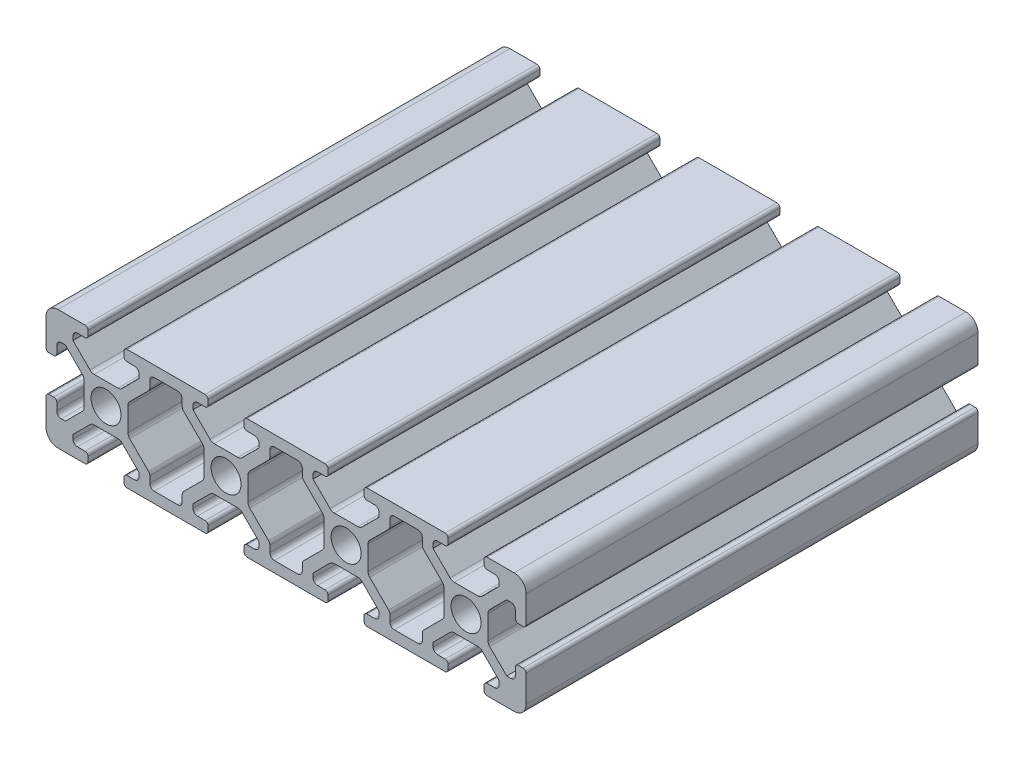
from build123d import *

# Parameters (mm, degrees)
SKETCH1_R           = 2.5
BOSS_EXTRUDE1_DEPTH = 75.3


with BuildPart() as part:
    # Sketch1 → Boss-Extrude1 (new body)
    with BuildSketch(Plane.XY):
        with BuildLine():
            Line((-37.639184242, -10.360815758), (-33.139184242, -10.360815758))
            ThreePointArc((-33.139184242, -10.360815758), (-32.785630852, -10.214369148), (-32.639184242, -9.860815758))
            Line((-32.639184242, -9.860815758), (-32.639184242, -9.060815758))
            ThreePointArc((-32.639184242, -9.060815758), (-32.785630852, -8.707262367), (-33.139184242, -8.560815758))
            Line((-33.139184242, -8.560815758), (-34.389184242, -8.560815758))
            ThreePointArc((-34.389184242, -8.560815758), (-34.919514328, -8.341145844), (-35.139184242, -7.810815758))
            Line((-35.139184242, -7.810815758), (-35.139184242, -7.133607964))
            Line((-35.139184242, -7.133607964), (-32.309285255, -4.303708976))
            ThreePointArc((-32.309285255, -4.303708976), (-31.984861906, -4.086936225), (-31.602178474, -4.010815758))
            Line((-31.602178474, -4.010815758), (-27.676190011, -4.010815758))
            ThreePointArc((-27.676190011, -4.010815758), (-27.293506578, -4.086936225), (-26.96908323, -4.303708976))
            Line((-26.96908323, -4.303708976), (-24.139184242, -7.133607964))
            Line((-24.139184242, -7.133607964), (-24.139184242, -7.810815758))
            ThreePointArc((-24.139184242, -7.810815758), (-24.358854156, -8.341145844), (-24.889184242, -8.560815758))
            Line((-24.889184242, -8.560815758), (-26.139184242, -8.560815758))
            ThreePointArc((-26.139184242, -8.560815758), (-26.492737633, -8.707262367), (-26.639184242, -9.060815758))
            Line((-26.639184242, -9.060815758), (-26.639184242, -9.860815758))
            ThreePointArc((-26.639184242, -9.860815758), (-26.492737633, -10.214369148), (-26.139184242, -10.360815758))
            Line((-26.139184242, -10.360815758), (-13.139184242, -10.360815758))
            ThreePointArc((-13.139184242, -10.360815758), (-12.785630852, -10.214369148), (-12.639184242, -9.860815758))
            Line((-12.639184242, -9.860815758), (-12.639184242, -9.060815758))
            ThreePointArc((-12.639184242, -9.060815758), (-12.785630852, -8.707262367), (-13.139184242, -8.560815758))
            Line((-13.139184242, -8.560815758), (-14.389184242, -8.560815758))
            ThreePointArc((-14.389184242, -8.560815758), (-14.919514328, -8.341145844), (-15.139184242, -7.810815758))
            Line((-15.139184242, -7.810815758), (-15.139184242, -7.133607964))
            Line((-15.139184242, -7.133607964), (-12.309285255, -4.303708976))
            ThreePointArc((-12.309285255, -4.303708976), (-11.984861906, -4.086936225), (-11.602178474, -4.010815758))
            Line((-11.602178474, -4.010815758), (-7.676190011, -4.010815758))
            ThreePointArc((-7.676190011, -4.010815758), (-7.293506578, -4.086936225), (-6.96908323, -4.303708976))
            Line((-6.96908323, -4.303708976), (-4.139184242, -7.133607964))
            Line((-4.139184242, -7.133607964), (-4.139184242, -7.810815758))
            ThreePointArc((-4.139184242, -7.810815758), (-4.358854156, -8.341145844), (-4.889184242, -8.560815758))
            Line((-4.889184242, -8.560815758), (-6.139184242, -8.560815758))
            ThreePointArc((-6.139184242, -8.560815758), (-6.492737633, -8.707262367), (-6.639184242, -9.060815758))
            Line((-6.639184242, -9.060815758), (-6.639184242, -9.860815758))
            ThreePointArc((-6.639184242, -9.860815758), (-6.492737633, -10.214369148), (-6.139184242, -10.360815758))
            Line((-6.139184242, -10.360815758), (6.860815758, -10.360815758))
            ThreePointArc((6.860815758, -10.360815758), (7.214369148, -10.214369148), (7.360815758, -9.860815758))
            Line((7.360815758, -9.860815758), (7.360815758, -9.060815758))
            ThreePointArc((7.360815758, -9.060815758), (7.214369148, -8.707262367), (6.860815758, -8.560815758))
            Line((6.860815758, -8.560815758), (5.610815758, -8.560815758))
            ThreePointArc((5.610815758, -8.560815758), (5.080485672, -8.341145844), (4.860815758, -7.810815758))
            Line((4.860815758, -7.810815758), (4.860815758, -7.133607964))
            Line((4.860815758, -7.133607964), (7.690714745, -4.303708976))
            ThreePointArc((7.690714745, -4.303708976), (8.015138094, -4.086936225), (8.397821526, -4.010815758))
            Line((8.397821526, -4.010815758), (12.323809989, -4.010815758))
            ThreePointArc((12.323809989, -4.010815758), (12.706493422, -4.086936225), (13.03091677, -4.303708976))
            Line((13.03091677, -4.303708976), (15.860815758, -7.133607964))
            Line((15.860815758, -7.133607964), (15.860815758, -7.810815758))
            ThreePointArc((15.860815758, -7.810815758), (15.641145844, -8.341145844), (15.110815758, -8.560815758))
            Line((15.110815758, -8.560815758), (13.860815758, -8.560815758))
            ThreePointArc((13.860815758, -8.560815758), (13.507262367, -8.707262367), (13.360815758, -9.060815758))
            Line((13.360815758, -9.060815758), (13.360815758, -9.860815758))
            ThreePointArc((13.360815758, -9.860815758), (13.507262367, -10.214369148), (13.860815758, -10.360815758))
            Line((13.860815758, -10.360815758), (26.860815758, -10.360815758))
            ThreePointArc((26.860815758, -10.360815758), (27.214369148, -10.214369148), (27.360815758, -9.860815758))
            Line((27.360815758, -9.860815758), (27.360815758, -9.060815758))
            ThreePointArc((27.360815758, -9.060815758), (27.214369148, -8.707262367), (26.860815758, -8.560815758))
            Line((26.860815758, -8.560815758), (25.610815758, -8.560815758))
            ThreePointArc((25.610815758, -8.560815758), (25.080485672, -8.341145844), (24.860815758, -7.810815758))
            Line((24.860815758, -7.810815758), (24.860815758, -7.133607964))
            Line((24.860815758, -7.133607964), (27.690714745, -4.303708976))
            ThreePointArc((27.690714745, -4.303708976), (28.015138094, -4.086936225), (28.397821526, -4.010815758))
            Line((28.397821526, -4.010815758), (32.323809989, -4.010815758))
            ThreePointArc((32.323809989, -4.010815758), (32.706493422, -4.086936225), (33.03091677, -4.303708976))
            Line((33.03091677, -4.303708976), (35.860815758, -7.133607964))
            Line((35.860815758, -7.133607964), (35.860815758, -7.810815758))
            ThreePointArc((35.860815758, -7.810815758), (35.641145844, -8.341145844), (35.110815758, -8.560815758))
            Line((35.110815758, -8.560815758), (33.860815758, -8.560815758))
            ThreePointArc((33.860815758, -8.560815758), (33.507262367, -8.707262367), (33.360815758, -9.060815758))
            Line((33.360815758, -9.060815758), (33.360815758, -9.860815758))
            ThreePointArc((33.360815758, -9.860815758), (33.507262367, -10.214369148), (33.860815758, -10.360815758))
            Line((33.860815758, -10.360815758), (38.360815758, -10.360815758))
            ThreePointArc((38.360815758, -10.360815758), (39.77502932, -9.77502932), (40.360815758, -8.360815758))
            Line((40.360815758, -8.360815758), (40.360815758, -3.860815758))
            ThreePointArc((40.360815758, -3.860815758), (40.214369148, -3.507262367), (39.860815758, -3.360815758))
            Line((39.860815758, -3.360815758), (39.060815758, -3.360815758))
            ThreePointArc((39.060815758, -3.360815758), (38.707262367, -3.507262367), (38.560815758, -3.860815758))
            Line((38.560815758, -3.860815758), (38.560815758, -5.110815758))
            ThreePointArc((38.560815758, -5.110815758), (38.341145844, -5.641145844), (37.810815758, -5.860815758))
            Line((37.810815758, -5.860815758), (37.133607964, -5.860815758))
            Line((37.133607964, -5.860815758), (34.303708976, -3.03091677))
            ThreePointArc((34.303708976, -3.03091677), (34.086936225, -2.706493422), (34.010815758, -2.323809989))
            Line((34.010815758, -2.323809989), (34.010815758, 1.602178474))
            ThreePointArc((34.010815758, 1.602178474), (34.086936225, 1.984861906), (34.303708976, 2.309285255))
            Line((34.303708976, 2.309285255), (37.133607964, 5.139184242))
            Line((37.133607964, 5.139184242), (37.810815758, 5.139184242))
            ThreePointArc((37.810815758, 5.139184242), (38.341145844, 4.919514328), (38.560815758, 4.389184242))
            Line((38.560815758, 4.389184242), (38.560815758, 3.139184242))
            ThreePointArc((38.560815758, 3.139184242), (38.707262367, 2.785630852), (39.060815758, 2.639184242))
            Line((39.060815758, 2.639184242), (39.860815758, 2.639184242))
            ThreePointArc((39.860815758, 2.639184242), (40.214369148, 2.785630852), (40.360815758, 3.139184242))
            Line((40.360815758, 3.139184242), (40.360815758, 7.639184242))
            ThreePointArc((40.360815758, 7.639184242), (39.77502932, 9.053397805), (38.360815758, 9.639184242))
            Line((38.360815758, 9.639184242), (33.860815758, 9.639184242))
            ThreePointArc((33.860815758, 9.639184242), (33.507262367, 9.492737633), (33.360815758, 9.139184242))
            Line((33.360815758, 9.139184242), (33.360815758, 8.339184242))
            ThreePointArc((33.360815758, 8.339184242), (33.507262367, 7.985630852), (33.860815758, 7.839184242))
            Line((33.860815758, 7.839184242), (35.110815758, 7.839184242))
            ThreePointArc((35.110815758, 7.839184242), (35.641145844, 7.619514328), (35.860815758, 7.089184242))
            Line((35.860815758, 7.089184242), (35.860815758, 6.411976448))
            Line((35.860815758, 6.411976448), (33.03091677, 3.582077461))
            ThreePointArc((33.03091677, 3.582077461), (32.706493422, 3.36530471), (32.323809989, 3.289184242))
            Line((32.323809989, 3.289184242), (28.397821526, 3.289184242))
            ThreePointArc((28.397821526, 3.289184242), (28.015138094, 3.36530471), (27.690714745, 3.582077461))
            Line((27.690714745, 3.582077461), (24.860815758, 6.411976448))
            Line((24.860815758, 6.411976448), (24.860815758, 7.089184242))
            ThreePointArc((24.860815758, 7.089184242), (25.080485672, 7.619514328), (25.610815758, 7.839184242))
            Line((25.610815758, 7.839184242), (26.860815758, 7.839184242))
            ThreePointArc((26.860815758, 7.839184242), (27.214369148, 7.985630852), (27.360815758, 8.339184242))
            Line((27.360815758, 8.339184242), (27.360815758, 9.139184242))
            ThreePointArc((27.360815758, 9.139184242), (27.214369148, 9.492737633), (26.860815758, 9.639184242))
            Line((26.860815758, 9.639184242), (13.860815758, 9.639184242))
            ThreePointArc((13.860815758, 9.639184242), (13.507262367, 9.492737633), (13.360815758, 9.139184242))
            Line((13.360815758, 9.139184242), (13.360815758, 8.339184242))
            ThreePointArc((13.360815758, 8.339184242), (13.507262367, 7.985630852), (13.860815758, 7.839184242))
            Line((13.860815758, 7.839184242), (15.110815758, 7.839184242))
            ThreePointArc((15.110815758, 7.839184242), (15.641145844, 7.619514328), (15.860815758, 7.089184242))
            Line((15.860815758, 7.089184242), (15.860815758, 6.411976448))
            Line((15.860815758, 6.411976448), (13.03091677, 3.582077461))
            ThreePointArc((13.03091677, 3.582077461), (12.706493422, 3.36530471), (12.323809989, 3.289184242))
            Line((12.323809989, 3.289184242), (8.397821526, 3.289184242))
            ThreePointArc((8.397821526, 3.289184242), (8.015138094, 3.36530471), (7.690714745, 3.582077461))
            Line((7.690714745, 3.582077461), (4.860815758, 6.411976448))
            Line((4.860815758, 6.411976448), (4.860815758, 7.089184242))
            ThreePointArc((4.860815758, 7.089184242), (5.080485672, 7.619514328), (5.610815758, 7.839184242))
            Line((5.610815758, 7.839184242), (6.860815758, 7.839184242))
            ThreePointArc((6.860815758, 7.839184242), (7.214369148, 7.985630852), (7.360815758, 8.339184242))
            Line((7.360815758, 8.339184242), (7.360815758, 9.139184242))
            ThreePointArc((7.360815758, 9.139184242), (7.214369148, 9.492737633), (6.860815758, 9.639184242))
            Line((6.860815758, 9.639184242), (-6.139184242, 9.639184242))
            ThreePointArc((-6.139184242, 9.639184242), (-6.492737633, 9.492737633), (-6.639184242, 9.139184242))
            Line((-6.639184242, 9.139184242), (-6.639184242, 8.339184242))
            ThreePointArc((-6.639184242, 8.339184242), (-6.492737633, 7.985630852), (-6.139184242, 7.839184242))
            Line((-6.139184242, 7.839184242), (-4.889184242, 7.839184242))
            ThreePointArc((-4.889184242, 7.839184242), (-4.358854156, 7.619514328), (-4.139184242, 7.089184242))
            Line((-4.139184242, 7.089184242), (-4.139184242, 6.411976448))
            Line((-4.139184242, 6.411976448), (-6.96908323, 3.582077461))
            ThreePointArc((-6.96908323, 3.582077461), (-7.293506578, 3.36530471), (-7.676190011, 3.289184242))
            Line((-7.676190011, 3.289184242), (-11.602178474, 3.289184242))
            ThreePointArc((-11.602178474, 3.289184242), (-11.984861906, 3.36530471), (-12.309285255, 3.582077461))
            Line((-12.309285255, 3.582077461), (-15.139184242, 6.411976448))
            Line((-15.139184242, 6.411976448), (-15.139184242, 7.089184242))
            ThreePointArc((-15.139184242, 7.089184242), (-14.919514328, 7.619514328), (-14.389184242, 7.839184242))
            Line((-14.389184242, 7.839184242), (-13.139184242, 7.839184242))
            ThreePointArc((-13.139184242, 7.839184242), (-12.785630852, 7.985630852), (-12.639184242, 8.339184242))
            Line((-12.639184242, 8.339184242), (-12.639184242, 9.139184242))
            ThreePointArc((-12.639184242, 9.139184242), (-12.785630852, 9.492737633), (-13.139184242, 9.639184242))
            Line((-13.139184242, 9.639184242), (-26.139184242, 9.639184242))
            ThreePointArc((-26.139184242, 9.639184242), (-26.492737633, 9.492737633), (-26.639184242, 9.139184242))
            Line((-26.639184242, 9.139184242), (-26.639184242, 8.339184242))
            ThreePointArc((-26.639184242, 8.339184242), (-26.492737633, 7.985630852), (-26.139184242, 7.839184242))
            Line((-26.139184242, 7.839184242), (-24.889184242, 7.839184242))
            ThreePointArc((-24.889184242, 7.839184242), (-24.358854156, 7.619514328), (-24.139184242, 7.089184242))
            Line((-24.139184242, 7.089184242), (-24.139184242, 6.411976448))
            Line((-24.139184242, 6.411976448), (-26.96908323, 3.582077461))
            ThreePointArc((-26.96908323, 3.582077461), (-27.293506578, 3.36530471), (-27.676190011, 3.289184242))
            Line((-27.676190011, 3.289184242), (-31.602178474, 3.289184242))
            ThreePointArc((-31.602178474, 3.289184242), (-31.984861906, 3.36530471), (-32.309285255, 3.582077461))
            Line((-32.309285255, 3.582077461), (-35.139184242, 6.411976448))
            Line((-35.139184242, 6.411976448), (-35.139184242, 7.089184242))
            ThreePointArc((-35.139184242, 7.089184242), (-34.919514328, 7.619514328), (-34.389184242, 7.839184242))
            Line((-34.389184242, 7.839184242), (-33.139184242, 7.839184242))
            ThreePointArc((-33.139184242, 7.839184242), (-32.785630852, 7.985630852), (-32.639184242, 8.339184242))
            Line((-32.639184242, 8.339184242), (-32.639184242, 9.139184242))
            ThreePointArc((-32.639184242, 9.139184242), (-32.785630852, 9.492737633), (-33.139184242, 9.639184242))
            Line((-33.139184242, 9.639184242), (-37.639184242, 9.639184242))
            ThreePointArc((-37.639184242, 9.639184242), (-39.053397805, 9.053397805), (-39.639184242, 7.639184242))
            Line((-39.639184242, 7.639184242), (-39.639184242, 3.139184242))
            ThreePointArc((-39.639184242, 3.139184242), (-39.492737633, 2.785630852), (-39.139184242, 2.639184242))
            Line((-39.139184242, 2.639184242), (-38.339184242, 2.639184242))
            ThreePointArc((-38.339184242, 2.639184242), (-37.985630852, 2.785630852), (-37.839184242, 3.139184242))
            Line((-37.839184242, 3.139184242), (-37.839184242, 4.389184242))
            ThreePointArc((-37.839184242, 4.389184242), (-37.619514328, 4.919514328), (-37.089184242, 5.139184242))
            Line((-37.089184242, 5.139184242), (-36.411976448, 5.139184242))
            Line((-36.411976448, 5.139184242), (-33.582077461, 2.309285255))
            ThreePointArc((-33.582077461, 2.309285255), (-33.36530471, 1.984861906), (-33.289184242, 1.602178474))
            Line((-33.289184242, 1.602178474), (-33.289184242, -2.323809989))
            ThreePointArc((-33.289184242, -2.323809989), (-33.36530471, -2.706493422), (-33.582077461, -3.03091677))
            Line((-33.582077461, -3.03091677), (-36.411976448, -5.860815758))
            Line((-36.411976448, -5.860815758), (-37.089184242, -5.860815758))
            ThreePointArc((-37.089184242, -5.860815758), (-37.619514328, -5.641145844), (-37.839184242, -5.110815758))
            Line((-37.839184242, -5.110815758), (-37.839184242, -3.860815758))
            ThreePointArc((-37.839184242, -3.860815758), (-37.985630852, -3.507262367), (-38.339184242, -3.360815758))
            Line((-38.339184242, -3.360815758), (-39.139184242, -3.360815758))
            ThreePointArc((-39.139184242, -3.360815758), (-39.492737633, -3.507262367), (-39.639184242, -3.860815758))
            Line((-39.639184242, -3.860815758), (-39.639184242, -8.360815758))
            ThreePointArc((-39.639184242, -8.360815758), (-39.053397805, -9.77502932), (-37.639184242, -10.360815758))
        make_face()
        with Locations(Location((-29.639184242, -0.360815758, 0), (0, 0, 180))):
            Circle(SKETCH1_R, mode=Mode.SUBTRACT)
        with Locations(Location((-9.639184242, -0.360815758, 0), (0, 0, 180))):
            Circle(SKETCH1_R, mode=Mode.SUBTRACT)
        with Locations(Location((10.360815758, -0.360815758, 0), (0, 0, 180))):
            Circle(SKETCH1_R, mode=Mode.SUBTRACT)
        with Locations(Location((30.360815758, -0.360815758, 0), (0, 0, 180))):
            Circle(SKETCH1_R, mode=Mode.SUBTRACT)
        with BuildLine():
            Line((-5.696291024, 2.309285255), (-2.558854156, 5.446722122))
            ThreePointArc((-2.558854156, 5.446722122), (-2.396274593, 5.690039634), (-2.339184242, 5.977052208))
            Line((-2.339184242, 5.977052208), (-2.339184242, 7.089184242))
            ThreePointArc((-2.339184242, 7.089184242), (-2.119514328, 7.619514328), (-1.589184242, 7.839184242))
            Line((-1.589184242, 7.839184242), (2.310815758, 7.839184242))
            ThreePointArc((2.310815758, 7.839184242), (2.841145844, 7.619514328), (3.060815758, 7.089184242))
            Line((3.060815758, 7.089184242), (3.060815758, 5.977052208))
            ThreePointArc((3.060815758, 5.977052208), (3.117906108, 5.690039634), (3.280485672, 5.446722122))
            Line((3.280485672, 5.446722122), (6.417922539, 2.309285255))
            ThreePointArc((6.417922539, 2.309285255), (6.63469529, 1.984861906), (6.710815758, 1.602178474))
            Line((6.710815758, 1.602178474), (6.710815758, -2.323809989))
            ThreePointArc((6.710815758, -2.323809989), (6.63469529, -2.706493422), (6.417922539, -3.03091677))
            Line((6.417922539, -3.03091677), (3.280485672, -6.168353637))
            ThreePointArc((3.280485672, -6.168353637), (3.117906108, -6.411671149), (3.060815758, -6.698683723))
            Line((3.060815758, -6.698683723), (3.060815758, -7.810815758))
            ThreePointArc((3.060815758, -7.810815758), (2.841145844, -8.341145844), (2.310815758, -8.560815758))
            Line((2.310815758, -8.560815758), (-1.589184242, -8.560815758))
            ThreePointArc((-1.589184242, -8.560815758), (-2.119514328, -8.341145844), (-2.339184242, -7.810815758))
            Line((-2.339184242, -7.810815758), (-2.339184242, -6.698683723))
            ThreePointArc((-2.339184242, -6.698683723), (-2.396274593, -6.411671149), (-2.558854156, -6.168353637))
            Line((-2.558854156, -6.168353637), (-5.696291024, -3.03091677))
            ThreePointArc((-5.696291024, -3.03091677), (-5.913063775, -2.706493422), (-5.989184242, -2.323809989))
            Line((-5.989184242, -2.323809989), (-5.989184242, 1.602178474))
            ThreePointArc((-5.989184242, 1.602178474), (-5.913063775, 1.984861906), (-5.696291024, 2.309285255))
        make_face(mode=Mode.SUBTRACT)
        with BuildLine():
            Line((-16.719514328, 5.446722122), (-13.582077461, 2.309285255))
            ThreePointArc((-13.582077461, 2.309285255), (-13.36530471, 1.984861906), (-13.289184242, 1.602178474))
            Line((-13.289184242, 1.602178474), (-13.289184242, -2.323809989))
            ThreePointArc((-13.289184242, -2.323809989), (-13.36530471, -2.706493422), (-13.582077461, -3.03091677))
            Line((-13.582077461, -3.03091677), (-16.719514328, -6.168353637))
            ThreePointArc((-16.719514328, -6.168353637), (-16.882093892, -6.411671149), (-16.939184242, -6.698683723))
            Line((-16.939184242, -6.698683723), (-16.939184242, -7.810815758))
            ThreePointArc((-16.939184242, -7.810815758), (-17.158854156, -8.341145844), (-17.689184242, -8.560815758))
            Line((-17.689184242, -8.560815758), (-21.589184242, -8.560815758))
            ThreePointArc((-21.589184242, -8.560815758), (-22.119514328, -8.341145844), (-22.339184242, -7.810815758))
            Line((-22.339184242, -7.810815758), (-22.339184242, -6.698683723))
            ThreePointArc((-22.339184242, -6.698683723), (-22.396274593, -6.411671149), (-22.558854156, -6.168353637))
            Line((-22.558854156, -6.168353637), (-25.696291024, -3.03091677))
            ThreePointArc((-25.696291024, -3.03091677), (-25.913063775, -2.706493422), (-25.989184242, -2.323809989))
            Line((-25.989184242, -2.323809989), (-25.989184242, 1.602178474))
            ThreePointArc((-25.989184242, 1.602178474), (-25.913063775, 1.984861906), (-25.696291024, 2.309285255))
            Line((-25.696291024, 2.309285255), (-22.558854156, 5.446722122))
            ThreePointArc((-22.558854156, 5.446722122), (-22.396274593, 5.690039634), (-22.339184242, 5.977052208))
            Line((-22.339184242, 5.977052208), (-22.339184242, 7.089184242))
            ThreePointArc((-22.339184242, 7.089184242), (-22.119514328, 7.619514328), (-21.589184242, 7.839184242))
            Line((-21.589184242, 7.839184242), (-17.689184242, 7.839184242))
            ThreePointArc((-17.689184242, 7.839184242), (-17.158854156, 7.619514328), (-16.939184242, 7.089184242))
            Line((-16.939184242, 7.089184242), (-16.939184242, 5.977052208))
            ThreePointArc((-16.939184242, 5.977052208), (-16.882093892, 5.690039634), (-16.719514328, 5.446722122))
        make_face(mode=Mode.SUBTRACT)
        with BuildLine():
            Line((23.280485672, 5.446722122), (26.417922539, 2.309285255))
            ThreePointArc((26.417922539, 2.309285255), (26.63469529, 1.984861906), (26.710815758, 1.602178474))
            Line((26.710815758, 1.602178474), (26.710815758, -2.323809989))
            ThreePointArc((26.710815758, -2.323809989), (26.63469529, -2.706493422), (26.417922539, -3.03091677))
            Line((26.417922539, -3.03091677), (23.280485672, -6.168353637))
            ThreePointArc((23.280485672, -6.168353637), (23.117906108, -6.411671149), (23.060815758, -6.698683723))
            Line((23.060815758, -6.698683723), (23.060815758, -7.810815758))
            ThreePointArc((23.060815758, -7.810815758), (22.841145844, -8.341145844), (22.310815758, -8.560815758))
            Line((22.310815758, -8.560815758), (18.410815758, -8.560815758))
            ThreePointArc((18.410815758, -8.560815758), (17.880485672, -8.341145844), (17.660815758, -7.810815758))
            Line((17.660815758, -7.810815758), (17.660815758, -6.698683723))
            ThreePointArc((17.660815758, -6.698683723), (17.603725407, -6.411671149), (17.441145844, -6.168353637))
            Line((17.441145844, -6.168353637), (14.303708976, -3.03091677))
            ThreePointArc((14.303708976, -3.03091677), (14.086936225, -2.706493422), (14.010815758, -2.323809989))
            Line((14.010815758, -2.323809989), (14.010815758, 1.602178474))
            ThreePointArc((14.010815758, 1.602178474), (14.086936225, 1.984861906), (14.303708976, 2.309285255))
            Line((14.303708976, 2.309285255), (17.441145844, 5.446722122))
            ThreePointArc((17.441145844, 5.446722122), (17.603725407, 5.690039634), (17.660815758, 5.977052208))
            Line((17.660815758, 5.977052208), (17.660815758, 7.089184242))
            ThreePointArc((17.660815758, 7.089184242), (17.880485672, 7.619514328), (18.410815758, 7.839184242))
            Line((18.410815758, 7.839184242), (22.310815758, 7.839184242))
            ThreePointArc((22.310815758, 7.839184242), (22.841145844, 7.619514328), (23.060815758, 7.089184242))
            Line((23.060815758, 7.089184242), (23.060815758, 5.977052208))
            ThreePointArc((23.060815758, 5.977052208), (23.117906108, 5.690039634), (23.280485672, 5.446722122))
        make_face(mode=Mode.SUBTRACT)
    extrude(amount=BOSS_EXTRUDE1_DEPTH)


solid = part.part
